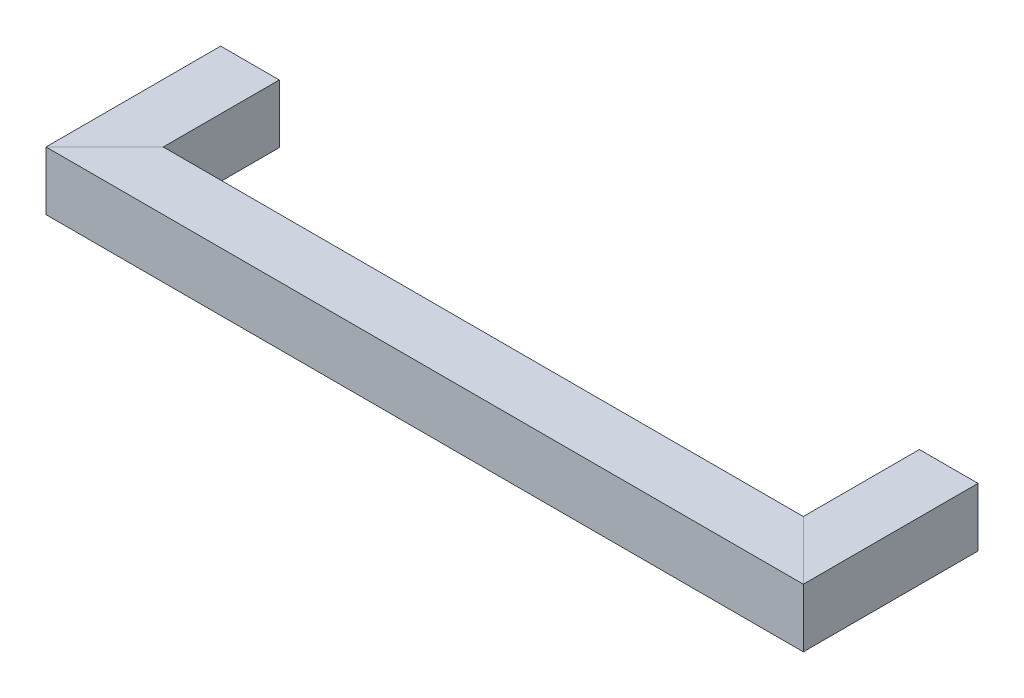
from build123d import *

# Parameters (mm, degrees)
SKETCH1_W = 25
SKETCH1_H = 25


with BuildPart() as part:
    # Sweep1: sweep along a path in Sketch2
    with BuildLine(Plane(origin=(0, 0, 0), x_dir=(1, 0, 0), z_dir=(0, 1, 0))) as sweep1_path:
        Line((0, 0), (0, -62))
        Line((0, -62), (298, -62))
        Line((298, -62), (298, 0))
    # Sketch1 → Sweep1 (sweep)
    with BuildSketch(Plane.XY):
        Rectangle(SKETCH1_W, SKETCH1_H)
    sweep(path=sweep1_path.line, transition=Transition.RIGHT)


solid = part.part
